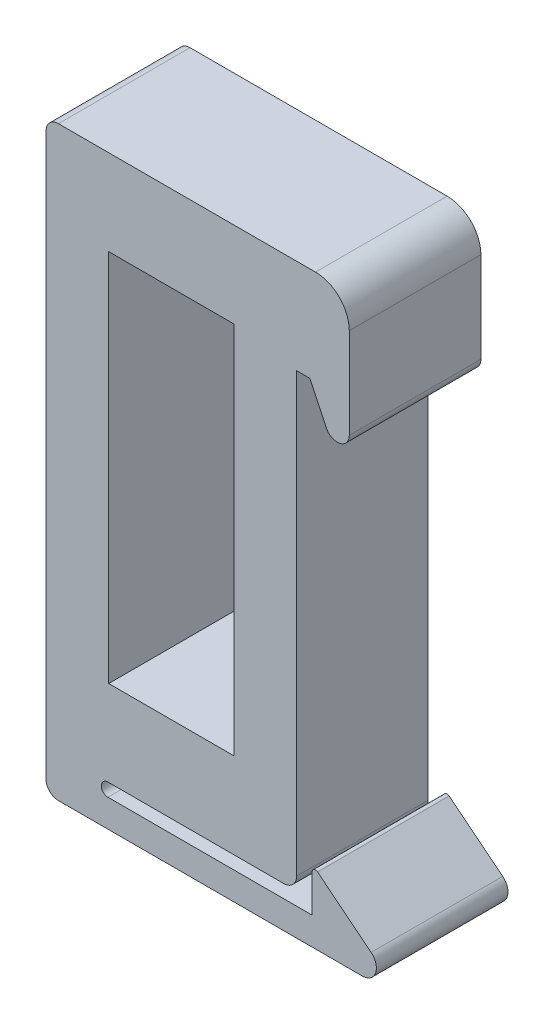
from build123d import *

# Parameters (mm, degrees)
SKETCH1_W           = 9.517416833
SKETCH1_H           = 28.418949141
BOSS_EXTRUDE2_DEPTH = 10
SKETCH4_R           = 1.138899504
CUT_EXTRUDE4_DEPTH  = 10


with BuildPart() as part:
    # Sketch1 → Boss-Extrude2 (new body)
    with BuildSketch(Plane.XY):
        with BuildLine():
            Line((52.348839191, 18.666807499), (52.348839191, 11.781367137))
            ThreePointArc((52.348839191, 11.781367137), (51.636993048, 10.890313034), (50.610732816, 11.387798993))
            Line((50.610732816, 11.387798993), (49.348838236, 14.031369137))
            Line((49.348838236, 14.031369137), (48.348839191, 14.031369137))
            Line((48.348839191, 14.031369137), (48.348839191, -19.226196728))
            ThreePointArc((48.348839191, -19.226196728), (48.061803836, -19.919161373), (47.368839191, -20.206196728))
            Line((47.368839191, -20.206196728), (34.006617177, -20.206196728))
            ThreePointArc((34.006617177, -20.206196728), (33.506618177, -20.706195728), (34.006617177, -21.206194728))
            Line((34.006617177, -21.206194728), (49.531176023, -21.206194728))
            Line((49.531176023, -21.206194728), (49.531176023, -18.353485574))
            ThreePointArc((49.531176023, -18.353485574), (49.672877658, -18.128161546), (49.937346497, -18.158269753))
            Line((49.937346497, -18.158269753), (54.007766524, -21.414600476))
            ThreePointArc((54.007766524, -21.414600476), (54.347138604, -22.597728023), (53.343040178, -23.309592161))
            Line((53.343040178, -23.309592161), (30.246422358, -23.309592161))
            ThreePointArc((30.246422358, -23.309592161), (29.581741984, -23.034272535), (29.306422358, -22.369592161))
            Line((29.306422358, -22.369592161), (29.306422358, 20.294472595))
            ThreePointArc((29.306422358, 20.294472595), (29.581741984, 20.959152969), (30.246422358, 21.234472595))
            Line((30.246422358, 21.234472595), (49.781174095, 21.234472595))
            ThreePointArc((49.781174095, 21.234472595), (51.596787496, 20.4824209), (52.348839191, 18.666807499))
        make_face()
        with Locations((38.827630775, 0.514998025)):
            Rectangle(SKETCH1_W, SKETCH1_H, mode=Mode.SUBTRACT)
    extrude(amount=BOSS_EXTRUDE2_DEPTH)

    # Sketch4 → Cut-Extrude4 (cut)
    with BuildSketch(Plane.ZY.offset(-29.306422358)):
        with Locations((4.548950863, 17.462440217)):
            Circle(SKETCH4_R)
        with Locations((4.551120241, -17.540074349)):
            Circle(SKETCH4_R)
    extrude(amount=-CUT_EXTRUDE4_DEPTH, mode=Mode.SUBTRACT)


solid = part.part
